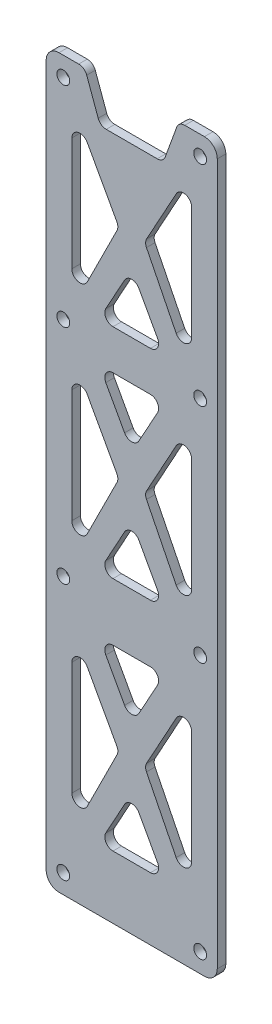
from build123d import *

# Parameters (mm, degrees)
CROQUIS1_R                 = 1.5
SALIENTE_EXTRUIR1_DEPTH    = 2
CORTAR_EXTRUIR1_DEPTH      = 96.880459427
CORTAR_EXTRUIR1_DEPTH_BACK = 2


with BuildPart() as part:
    # Croquis1 → Saliente-Extruir1 (new body)
    with BuildSketch(Plane.XY):
        with BuildLine():
            Line((-17, 93.75), (17, 93.75))
            ThreePointArc((17, 93.75), (19.121320344, 92.871320344), (20, 90.75))
            Line((20, 90.75), (20, -73.25))
            ThreePointArc((20, -73.25), (19.121320344, -75.371320344), (17, -76.25))
            Line((17, -76.25), (-17, -76.25))
            ThreePointArc((-17, -76.25), (-19.121320344, -75.371320344), (-20, -73.25))
            Line((-20, -73.25), (-20, 90.75))
            ThreePointArc((-20, 90.75), (-19.121320344, 92.871320344), (-17, 93.75))
        make_face()
        with Locations((-16, 89.25)):
            Circle(CROQUIS1_R, mode=Mode.SUBTRACT)
        with Locations((16, 89.25)):
            Circle(CROQUIS1_R, mode=Mode.SUBTRACT)
        with Locations((-16, 40.25)):
            Circle(CROQUIS1_R, mode=Mode.SUBTRACT)
        with Locations((16, 40.25)):
            Circle(CROQUIS1_R, mode=Mode.SUBTRACT)
        with Locations((-16, -11.75)):
            Circle(CROQUIS1_R, mode=Mode.SUBTRACT)
        with Locations((16, -11.75)):
            Circle(CROQUIS1_R, mode=Mode.SUBTRACT)
        with Locations((-16, -71.75)):
            Circle(CROQUIS1_R, mode=Mode.SUBTRACT)
        with Locations((16, -71.75)):
            Circle(CROQUIS1_R, mode=Mode.SUBTRACT)
    extrude(amount=SALIENTE_EXTRUIR1_DEPTH)

    # Croquis2 → Cortar-Extruir1 (cut, two sides: drawn at the far end of the back side and taken through both)
    with BuildSketch(Plane.XY.offset(2).offset(-CORTAR_EXTRUIR1_DEPTH_BACK)):
        with BuildLine():
            Line((12.400415076, 93.75), (-12.400415076, 93.75))
            ThreePointArc((-12.400415076, 93.75), (-11.253262204, 93.388304089), (-10.521029835, 92.434040287))
            Line((-10.521029835, 92.434040287), (-7.839267822, 85.065959713))
            ThreePointArc((-7.839267822, 85.065959713), (-7.107035454, 84.111695911), (-5.959882581, 83.75))
            Line((-5.959882581, 83.75), (5.959882581, 83.75))
            ThreePointArc((5.959882581, 83.75), (7.107035454, 84.111695911), (7.839267822, 85.065959713))
            Line((7.839267822, 85.065959713), (10.521029835, 92.434040287))
            ThreePointArc((10.521029835, 92.434040287), (11.253262204, 93.388304089), (12.400415076, 93.75))
        make_face()
        with BuildLine():
            ThreePointArc((-10.42045304, -27.2582672), (-12.566783681, -26.329827013), (-14, -28.177698054))
            Line((-14, -28.177698054), (-14, -54.668198657))
            ThreePointArc((-14, -54.668198657), (-12.530480645, -56.525016119), (-10.385708563, -55.521417127))
            Line((-10.385708563, -55.521417127), (-3.44772031, -41.64544062))
            ThreePointArc((-3.44772031, -41.64544062), (-3.246669118, -40.754834791), (-3.482464787, -39.872791296))
            Line((-3.482464787, -39.872791296), (-10.42045304, -27.2582672))
        make_face()
        with BuildLine():
            Line((10.42045304, -27.2582672), (3.482464787, -39.872791296))
            ThreePointArc((3.482464787, -39.872791296), (3.246669118, -40.754834791), (3.44772031, -41.64544062))
            Line((3.44772031, -41.64544062), (10.385708563, -55.521417127))
            ThreePointArc((10.385708563, -55.521417127), (12.530480645, -56.525016119), (14, -54.668198657))
            Line((14, -54.668198657), (14, -28.177698054))
            ThreePointArc((14, -28.177698054), (12.566783681, -26.329827013), (10.42045304, -27.2582672))
        make_face()
        with BuildLine():
            ThreePointArc((-4.385566091, -19.91383123), (-6.02782811, -20.850663459), (-6.057258554, -22.741116582))
            Line((-6.057258554, -22.741116582), (-1.671692462, -30.714873112))
            ThreePointArc((-1.671692462, -30.714873112), (0, -31.703296755), (1.671692462, -30.714873112))
            Line((1.671692462, -30.714873112), (6.057258554, -22.741116582))
            ThreePointArc((6.057258554, -22.741116582), (6.02782811, -20.850663459), (4.385566091, -19.91383123))
            Line((4.385566091, -19.91383123), (-4.385566091, -19.91383123))
        make_face()
        with BuildLine():
            Line((-4.385566091, -61.58616877), (4.385566091, -61.58616877))
            ThreePointArc((4.385566091, -61.58616877), (6.02782811, -60.649336541), (6.057258554, -58.758883418))
            Line((6.057258554, -58.758883418), (1.671692462, -50.785126888))
            ThreePointArc((1.671692462, -50.785126888), (0, -49.796703245), (-1.671692462, -50.785126888))
            Line((-1.671692462, -50.785126888), (-6.057258554, -58.758883418))
            ThreePointArc((-6.057258554, -58.758883418), (-6.02782811, -60.649336541), (-4.385566091, -61.58616877))
        make_face()
        with BuildLine():
            ThreePointArc((-10.42045304, 27.905564031), (-12.566783681, 28.834004217), (-14, 26.986133176))
            Line((-14, 26.986133176), (-14, 0.495632573))
            ThreePointArc((-14, 0.495632573), (-12.530480645, -1.361184889), (-10.385708563, -0.357585897))
            Line((-10.385708563, -0.357585897), (-3.44772031, 13.51839061))
            ThreePointArc((-3.44772031, 13.51839061), (-3.246669118, 14.408996439), (-3.482464787, 15.291039934))
            Line((-3.482464787, 15.291039934), (-10.42045304, 27.905564031))
        make_face()
        with BuildLine():
            Line((10.42045304, 27.905564031), (3.482464787, 15.291039934))
            ThreePointArc((3.482464787, 15.291039934), (3.246669118, 14.408996439), (3.44772031, 13.51839061))
            Line((3.44772031, 13.51839061), (10.385708563, -0.357585897))
            ThreePointArc((10.385708563, -0.357585897), (12.530480645, -1.361184889), (14, 0.495632573))
            Line((14, 0.495632573), (14, 26.986133176))
            ThreePointArc((14, 26.986133176), (12.566783681, 28.834004217), (10.42045304, 27.905564031))
        make_face()
        with BuildLine():
            ThreePointArc((-4.385566091, 35.25), (-6.02782811, 34.313167771), (-6.057258554, 32.422714648))
            Line((-6.057258554, 32.422714648), (-1.671692462, 24.448958118))
            ThreePointArc((-1.671692462, 24.448958118), (0, 23.460534475), (1.671692462, 24.448958118))
            Line((1.671692462, 24.448958118), (6.057258554, 32.422714648))
            ThreePointArc((6.057258554, 32.422714648), (6.02782811, 34.313167771), (4.385566091, 35.25))
            Line((4.385566091, 35.25), (-4.385566091, 35.25))
        make_face()
        with BuildLine():
            Line((-4.385566091, -6.42233754), (4.385566091, -6.42233754))
            ThreePointArc((4.385566091, -6.42233754), (6.02782811, -5.485505311), (6.057258554, -3.595052188))
            Line((6.057258554, -3.595052188), (1.671692462, 4.378704342))
            ThreePointArc((1.671692462, 4.378704342), (0, 5.367127985), (-1.671692462, 4.378704342))
            Line((-1.671692462, 4.378704342), (-6.057258554, -3.595052188))
            ThreePointArc((-6.057258554, -3.595052188), (-6.02782811, -5.485505311), (-4.385566091, -6.42233754))
        make_face()
        with BuildLine():
            ThreePointArc((-10.42045304, 78.905564031), (-12.566783681, 79.834004217), (-14, 77.986133176))
            Line((-14, 77.986133176), (-14, 51.495632573))
            ThreePointArc((-14, 51.495632573), (-12.530480645, 49.638815111), (-10.385708563, 50.642414103))
            Line((-10.385708563, 50.642414103), (-3.44772031, 64.51839061))
            ThreePointArc((-3.44772031, 64.51839061), (-3.246669118, 65.408996439), (-3.482464787, 66.291039934))
            Line((-3.482464787, 66.291039934), (-10.42045304, 78.905564031))
        make_face()
        with BuildLine():
            Line((10.42045304, 78.905564031), (3.482464787, 66.291039934))
            ThreePointArc((3.482464787, 66.291039934), (3.246669118, 65.408996439), (3.44772031, 64.51839061))
            Line((3.44772031, 64.51839061), (10.385708563, 50.642414103))
            ThreePointArc((10.385708563, 50.642414103), (12.530480645, 49.638815111), (14, 51.495632573))
            Line((14, 51.495632573), (14, 77.986133176))
            ThreePointArc((14, 77.986133176), (12.566783681, 79.834004217), (10.42045304, 78.905564031))
        make_face()
        with BuildLine():
            Line((-4.385566091, 44.57766246), (4.385566091, 44.57766246))
            ThreePointArc((4.385566091, 44.57766246), (6.02782811, 45.514494689), (6.057258554, 47.404947812))
            Line((6.057258554, 47.404947812), (1.671692462, 55.378704342))
            ThreePointArc((1.671692462, 55.378704342), (0, 56.367127985), (-1.671692462, 55.378704342))
            Line((-1.671692462, 55.378704342), (-6.057258554, 47.404947812))
            ThreePointArc((-6.057258554, 47.404947812), (-6.02782811, 45.514494689), (-4.385566091, 44.57766246))
        make_face()
    extrude(amount=CORTAR_EXTRUIR1_DEPTH + CORTAR_EXTRUIR1_DEPTH_BACK, mode=Mode.SUBTRACT)


solid = part.part
